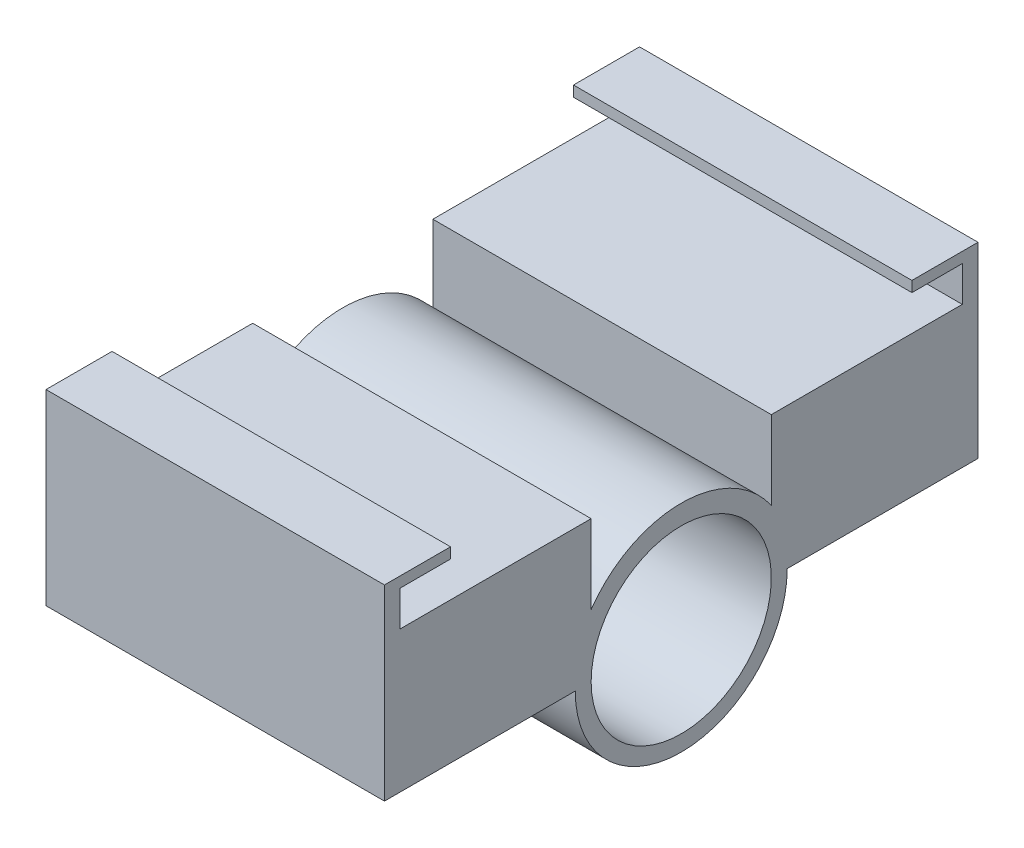
from build123d import *

# Parameters (mm, degrees)
BOSS_EXTRUDE1_DEPTH = 47.9


with BuildPart() as part:
    # Sketch1 → Boss-Extrude1 (new body)
    with BuildSketch(Plane(origin=(0, 0, 0), x_dir=(0, 0, -1), z_dir=(1, 0, 0))):
        with BuildLine():
            Line((-15, 0), (-42, 0))
            Line((-42, 0), (-42, 26.5))
            Line((-42, 26.5), (-32.65, 26.5))
            Line((-32.65, 26.5), (-32.65, 25))
            Line((-32.65, 25), (-39.775, 25))
            Line((-39.775, 25), (-39.775, 20))
            Line((-39.775, 20), (-12.75, 20))
            Line((-12.75, 20), (-12.75, 8.865100112))
            ThreePointArc((-12.75, 8.865100112), (0, 15.529085614), (12.75, 8.865100112))
            Line((12.75, 8.865100112), (12.75, 20))
            Line((12.75, 20), (39.775, 20))
            Line((39.775, 20), (39.775, 25))
            Line((39.775, 25), (32.65, 25))
            Line((32.65, 25), (32.65, 26.5))
            Line((32.65, 26.5), (42, 26.5))
            Line((42, 26.5), (42, 0))
            Line((42, 0), (15, 0))
            ThreePointArc((15, 0), (0, -15), (-15, 0))
        make_face()
        with BuildLine():
            ThreePointArc((-12.75, 0), (0, -12.75), (12.75, 0))
            ThreePointArc((12.75, 0), (0, 12.75), (-12.75, 0))
        make_face(mode=Mode.SUBTRACT)
    extrude(amount=BOSS_EXTRUDE1_DEPTH)


solid = part.part
